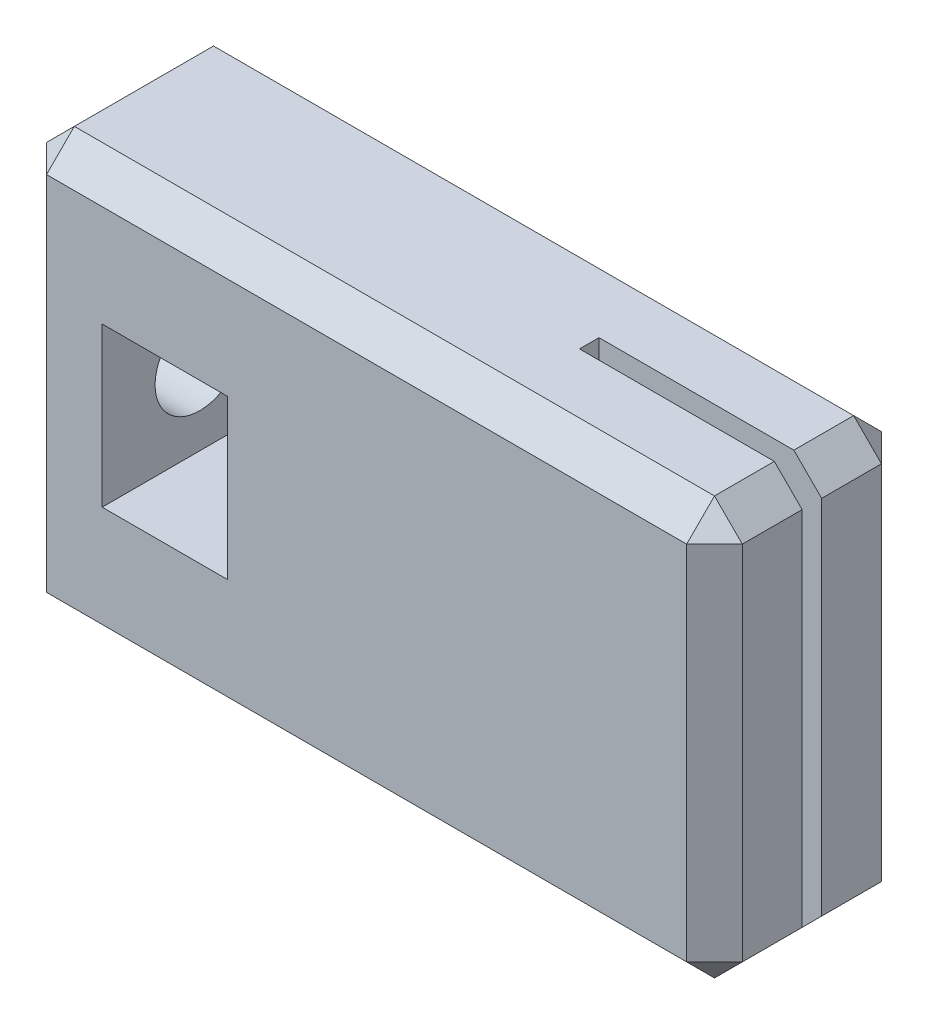
from build123d import *

# Parameters (mm, degrees)
BOSS_EXTRUDE1_DEPTH = 7.5
SKETCH3_R           = 1.6
CUT_EXTRUDE1_DEPTH  = 16
SKETCH4_W           = 4.5
SKETCH4_H           = 5.7
CUT_EXTRUDE2_DEPTH  = 28.023138234
CHAMFER1_SIZE       = 1


with BuildPart() as part:
    # Sketch2 → Boss-Extrude1 (new, symmetric)
    with BuildSketch(Plane(origin=(0, 0, 0), x_dir=(1, 0, 0), z_dir=(0, 1, 0))):
        Polygon((25, -0.35), (25, -3.5), (0, -3.5), (0, 3.5), (25, 3.5), (25, 0.35), (17, 0.35), (17, -0.35), align=None)
    extrude(amount=BOSS_EXTRUDE1_DEPTH, both=True)

    # Sketch3 → Cut-Extrude1 (cut)
    with BuildSketch(Plane.ZY):
        Circle(SKETCH3_R)
    extrude(amount=-CUT_EXTRUDE1_DEPTH, mode=Mode.SUBTRACT)

    # Sketch4 → Cut-Extrude2 (cut, through all)
    with BuildSketch(Plane.XY.offset(3.5)):
        with Locations((5.25, 0)):
            Rectangle(SKETCH4_W, SKETCH4_H)
    extrude(amount=-CUT_EXTRUDE2_DEPTH, mode=Mode.SUBTRACT)

    # Chamfer1
    chamfer1_edges = [part.edges().sort_by_distance(p)[0] for p in [
        (25, 7.5, 1.925),
        (12.5, -7.5, 3.5),
        (0, -7.5, 0),
        (0, 0, -3.5),
        (25, 0, -3.5),
        (25, 0, 3.5),
        (0, 0, 3.5),
        (25, 7.5, -1.925),
        (12.5, 7.5, -3.5),
        (0, 7.5, 0),
        (12.5, 7.5, 3.5),
        (12.5, -7.5, -3.5),
        (25, -7.5, -1.925),
        (25, -7.5, 1.925),
    ]]
    chamfer(chamfer1_edges, length=CHAMFER1_SIZE)


solid = part.part
